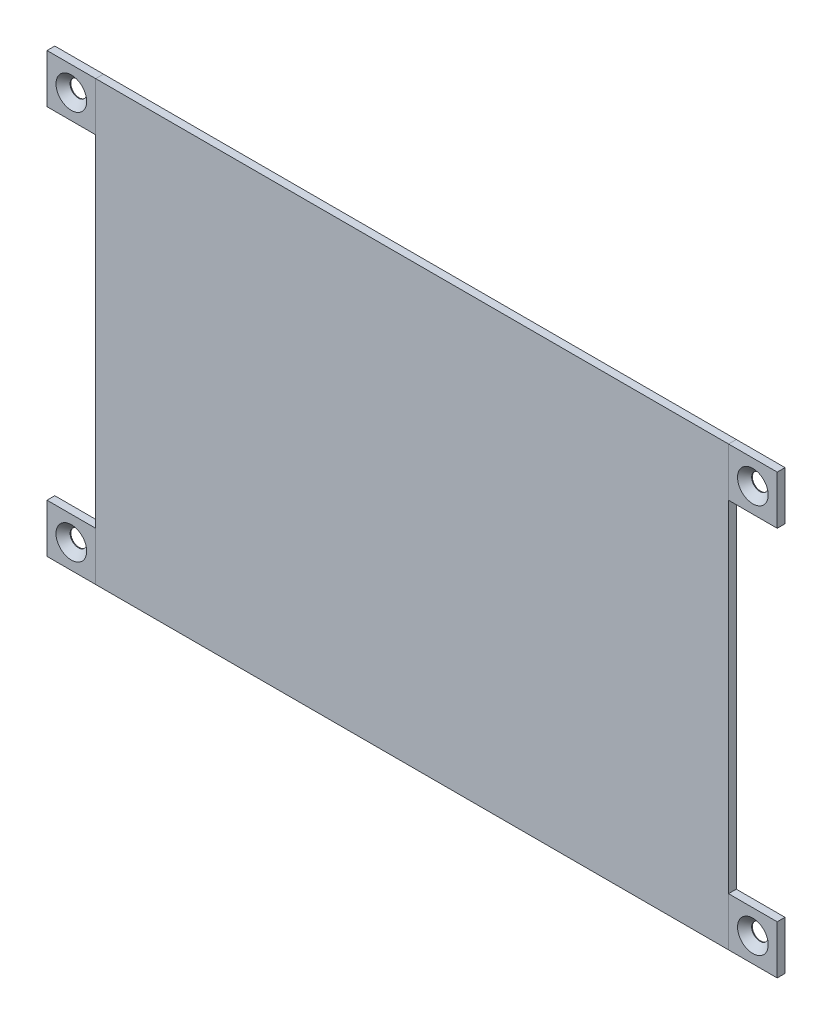
from build123d import *

# Parameters (mm, degrees)
SKETCH1_W                                    = 130
SKETCH1_H                                    = 90
BOSS_EXTRUDE1_DEPTH                          = 1.6
SKETCH2_W                                    = 10
SKETCH2_H                                    = 10
BOSS_EXTRUDE2_DEPTH                          = 1.6
BOSS_EXTRUDE2_2_DEPTH                        = 1.6
BOSS_EXTRUDE2_3_DEPTH                        = 1.6
BOSS_EXTRUDE2_4_DEPTH                        = 1.6
CSK_FOR_M3_COUNTERSUNK_FLAT_HEAD_SCR_2_COUNT = 2
CSK_FOR_M3_COUNTERSUNK_FLAT_HEAD_SCR_2_PITCH = 140
CSK_FOR_M3_COUNTERSUNK_FLAT_HEAD_SCR_3_COUNT = 2
CSK_FOR_M3_COUNTERSUNK_FLAT_HEAD_SCR_3_PITCH = 161.245154966
CSK_FOR_M3_COUNTERSUNK_FLAT_HEAD_SCR_4_COUNT = 2
CSK_FOR_M3_COUNTERSUNK_FLAT_HEAD_SCR_4_PITCH = 80


with BuildPart() as part:
    # Sketch1 → Boss-Extrude1 (new body)
    with BuildSketch(Plane.XY):
        with Locations((65, 45)):
            Rectangle(SKETCH1_W, SKETCH1_H)
    extrude(amount=BOSS_EXTRUDE1_DEPTH)


with BuildPart() as body_2:
    # Sketch2 → Boss-Extrude2 (new body)
    with BuildSketch(Plane(origin=(0, 0, 0), x_dir=(-1, 0, 0), z_dir=(0, 0, -1))):
        with Locations((-135, 85)):
            Rectangle(SKETCH2_W, SKETCH2_H)
    extrude(amount=-BOSS_EXTRUDE2_DEPTH)


with BuildPart() as body_3:
    # Sketch2 → Boss-Extrude2 2 (new body)
    with BuildSketch(Plane(origin=(0, 0, 0), x_dir=(-1, 0, 0), z_dir=(0, 0, -1))):
        with Locations((-135, 5)):
            Rectangle(SKETCH2_W, SKETCH2_H)
    extrude(amount=-BOSS_EXTRUDE2_2_DEPTH)


with BuildPart() as body_4:
    # Sketch2 → Boss-Extrude2 3 (new body)
    with BuildSketch(Plane(origin=(0, 0, 0), x_dir=(-1, 0, 0), z_dir=(0, 0, -1))):
        with Locations((5, 5)):
            Rectangle(SKETCH2_W, SKETCH2_H)
    extrude(amount=-BOSS_EXTRUDE2_3_DEPTH)


with BuildPart() as body_5:
    # Sketch2 → Boss-Extrude2 4 (new body)
    with BuildSketch(Plane(origin=(0, 0, 0), x_dir=(-1, 0, 0), z_dir=(0, 0, -1))):
        with Locations((5, 85)):
            Rectangle(SKETCH2_W, SKETCH2_H)
    extrude(amount=-BOSS_EXTRUDE2_4_DEPTH)

    # Sketch5 → CSK for M3 Countersunk Flat Head Screw1 (revolve, cut)
    with BuildSketch(Plane(origin=(-5, 85, 1.6), x_dir=(0, -1, 0), z_dir=(1, 0, 0))):
        Polygon((0, 0), (0, 31.021463052), (1.7, 30), (1.7, 1.45), (3.15, 0), align=None)
    csk_for_m3_countersunk_flat_head_screw1 = revolve(axis=Axis((-5, 85, 7.95), (0, 0, -1)), mode=Mode.SUBTRACT)


with BuildPart() as body_2_1:
    add(body_2.part)

    # CSK for M3 Countersunk Flat Head Scr 2: CSK for M3 Countersunk Flat Head Screw1 ×2
    with Locations(*[(i * CSK_FOR_M3_COUNTERSUNK_FLAT_HEAD_SCR_2_PITCH, 0, 0) for i in range(1, CSK_FOR_M3_COUNTERSUNK_FLAT_HEAD_SCR_2_COUNT)]):
        add(csk_for_m3_countersunk_flat_head_screw1, mode=Mode.SUBTRACT)


with BuildPart() as body_3_1:
    add(body_3.part)

    # CSK for M3 Countersunk Flat Head Scr 3: CSK for M3 Countersunk Flat Head Screw1 ×2
    with Locations(*[Vector(0.8682431421244593, -0.49613893835683387, 0) * (i * CSK_FOR_M3_COUNTERSUNK_FLAT_HEAD_SCR_3_PITCH) for i in range(1, CSK_FOR_M3_COUNTERSUNK_FLAT_HEAD_SCR_3_COUNT)]):
        add(csk_for_m3_countersunk_flat_head_screw1, mode=Mode.SUBTRACT)


with BuildPart() as body_4_1:
    add(body_4.part)

    # CSK for M3 Countersunk Flat Head Scr 4: CSK for M3 Countersunk Flat Head Screw1 ×2
    with Locations(*[(0, -i * CSK_FOR_M3_COUNTERSUNK_FLAT_HEAD_SCR_4_PITCH, 0) for i in range(1, CSK_FOR_M3_COUNTERSUNK_FLAT_HEAD_SCR_4_COUNT)]):
        add(csk_for_m3_countersunk_flat_head_screw1, mode=Mode.SUBTRACT)


solid = Compound([part.part, body_5.part, body_2_1.part, body_3_1.part, body_4_1.part])
